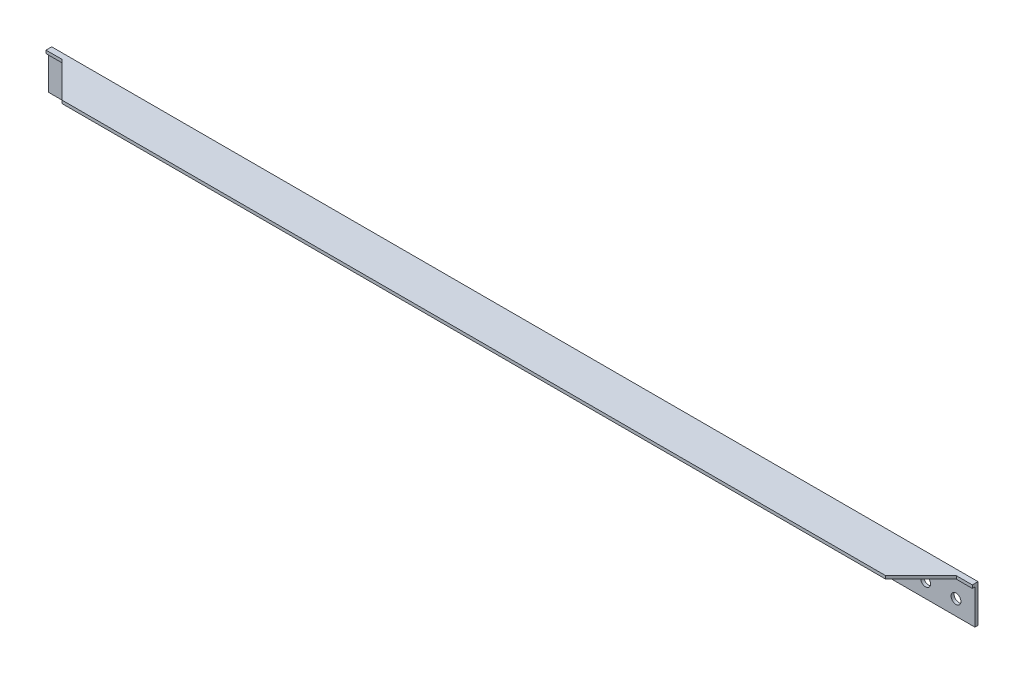
from build123d import *

# Parameters (mm, degrees)
SKETCH_1_W          = 2440
SKETCH_1_H          = 100
SKETCH_1_R          = 13
EXTRUDE_770_DEPTH   = 8
SKETCH_2_W          = 2440
SKETCH_2_H          = 8
EXTRUDE_1_DEPTH     = 100
CUT_EXTRUDE_1_DEPTH = 1229.846613699


with BuildPart() as part:
    # 草图1 → Extrude 770 (new body)
    with BuildSketch(Plane.XY):
        with Locations((0, 50)):
            Rectangle(SKETCH_1_W, SKETCH_1_H)
        with Locations((1090, 40)):
            Circle(SKETCH_1_R, mode=Mode.SUBTRACT)
        with Locations((1170, 40)):
            Circle(SKETCH_1_R, mode=Mode.SUBTRACT)
        with Locations(Location((-1170, 40, 0), (0, 0, 180))):
            Circle(SKETCH_1_R, mode=Mode.SUBTRACT)
        with Locations(Location((-1090, 40, 0), (0, 0, 180))):
            Circle(SKETCH_1_R, mode=Mode.SUBTRACT)
        with Locations((0, 40)):
            Circle(SKETCH_1_R, mode=Mode.SUBTRACT)
        with Locations((80, 40)):
            Circle(SKETCH_1_R, mode=Mode.SUBTRACT)
        with Locations((160, 40)):
            Circle(SKETCH_1_R, mode=Mode.SUBTRACT)
        with Locations(Location((-160, 40, 0), (0, 0, 180))):
            Circle(SKETCH_1_R, mode=Mode.SUBTRACT)
        with Locations(Location((-80, 40, 0), (0, 0, 180))):
            Circle(SKETCH_1_R, mode=Mode.SUBTRACT)
    extrude(amount=EXTRUDE_770_DEPTH)

    # 草图2 → 凸台-拉伸1 (add)
    with BuildSketch(Plane.XY.offset(8)):
        with Locations((0, 96)):
            Rectangle(SKETCH_2_W, SKETCH_2_H)
    extrude(amount=EXTRUDE_1_DEPTH)

    # 草图3 → 切除-拉伸1 (cut, through all)
    with BuildSketch(Plane(origin=(0, 100, 0), x_dir=(-1, 0, 0), z_dir=(0, 1, 0))):
        Polygon((-1085, 108), (-1178, 15), (-1220, 15), (-1220, 108), align=None)
        Polygon((1220, 15), (1178, 15), (1085, 108), (1220, 108), align=None)
    extrude(amount=-CUT_EXTRUDE_1_DEPTH, mode=Mode.SUBTRACT)


solid = part.part
